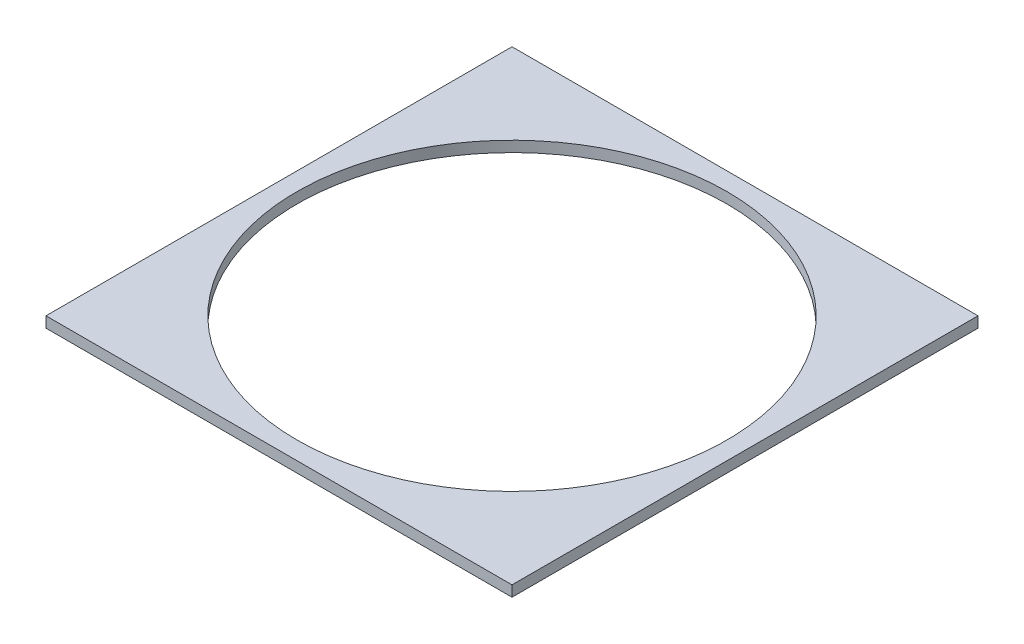
from build123d import *

# Parameters (mm, degrees)
SKETCH1_W           = 330.2
SKETCH1_H           = 330.2
SKETCH1_R           = 152.4
BOSS_EXTRUDE1_DEPTH = 7.62


with BuildPart() as part:
    # Sketch1 → Boss-Extrude1 (new body)
    with BuildSketch(Plane(origin=(0, 0, 0), x_dir=(1, 0, 0), z_dir=(0, 1, 0))):
        Rectangle(SKETCH1_W, SKETCH1_H)
        with Locations(Location((0, 0, 0), (0, 0, 90))):
            Circle(SKETCH1_R, mode=Mode.SUBTRACT)
    extrude(amount=BOSS_EXTRUDE1_DEPTH)


solid = part.part
